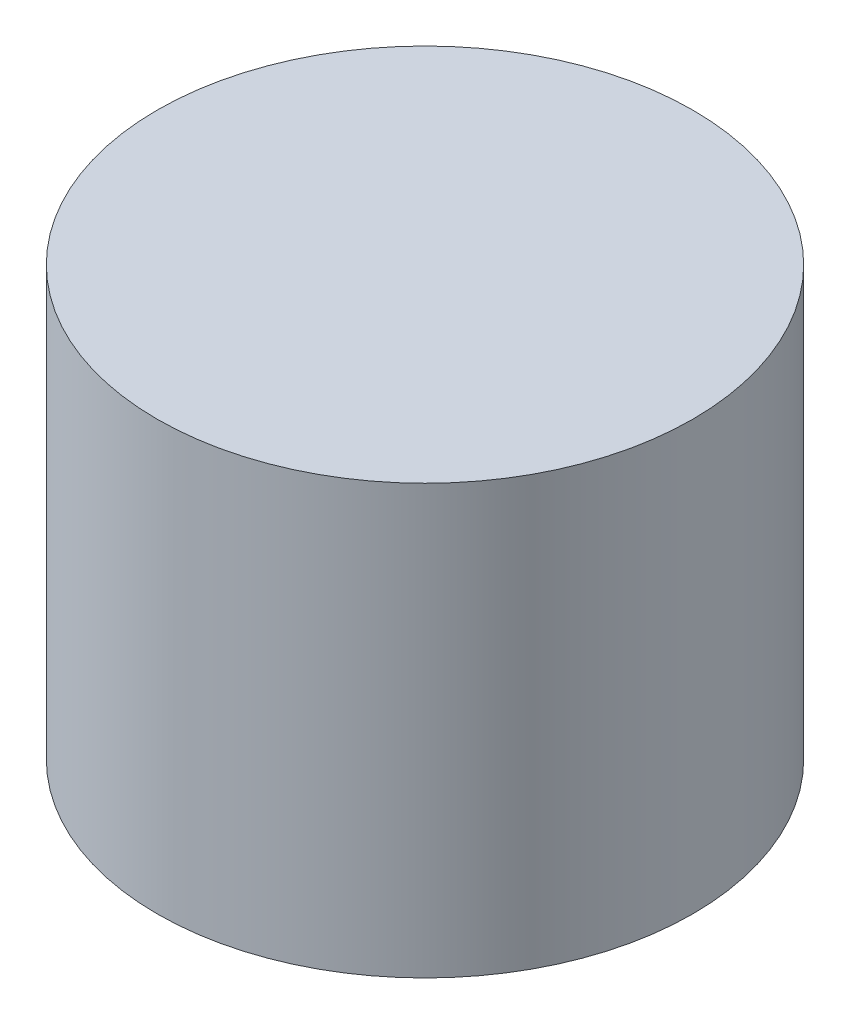
from build123d import *

# Parameters (mm, degrees)
SKETCH1_R           = 12.5
BOSS_EXTRUDE1_DEPTH = 20


with BuildPart() as part:
    # Sketch1 → Boss-Extrude1 (new body)
    with BuildSketch(Plane(origin=(0, 0, 0), x_dir=(1, 0, 0), z_dir=(0, 1, 0))):
        with Locations(Location((-12.667008096, -5.855714778, 0), (0, 0, 270))):
            Circle(SKETCH1_R)
    extrude(amount=BOSS_EXTRUDE1_DEPTH)


solid = part.part
